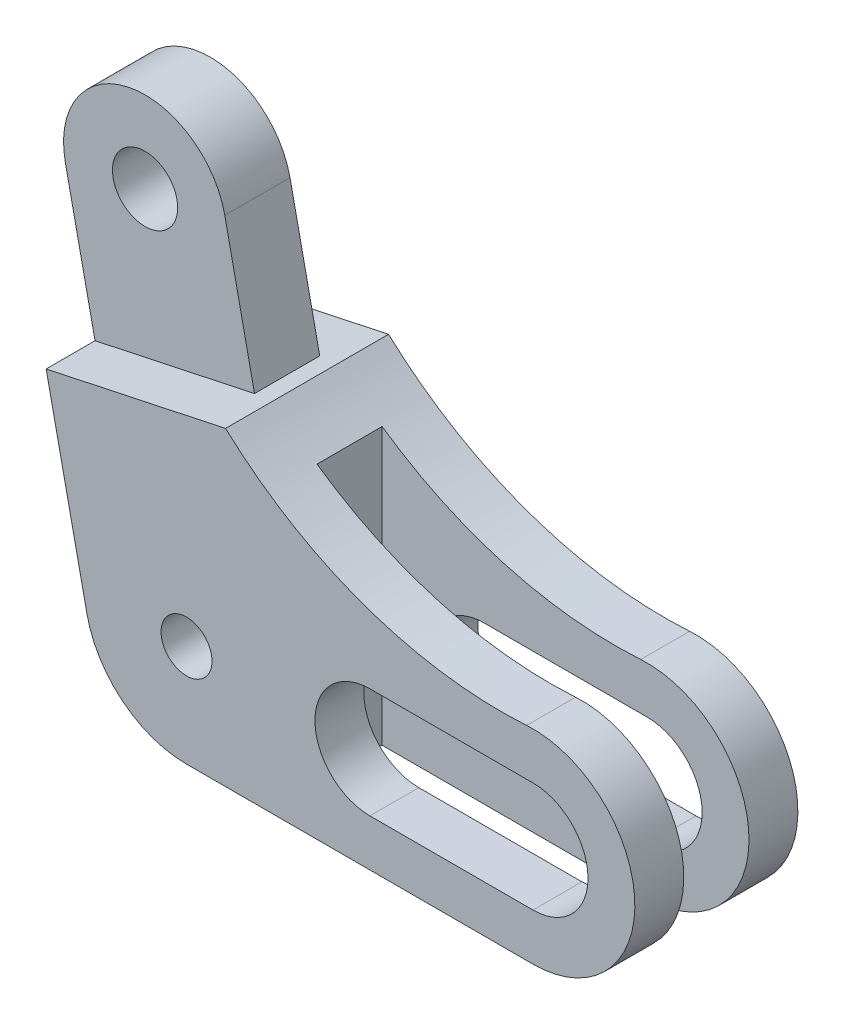
from build123d import *

# Parameters (mm, degrees)
SKETCH2_R               = 6.25
BOSS_EXTRUDE1_DEPTH     = 20
CUT_EXTRUDE1_DEPTH      = 123.932823709
CUT_EXTRUDE1_DEPTH_BACK = 123.932823709
SKETCH4_W               = 90
SKETCH4_H               = 16
SKETCH5_R               = 8
BOSS_EXTRUDE2_DEPTH     = 8


with BuildPart() as part:
    # Sketch2 → Boss-Extrude1 (new, symmetric)
    with BuildSketch(Plane.XY):
        with BuildLine():
            Line((0, -25), (85, -25))
            ThreePointArc((85, -25), (109.987866766, 0.7787904), (83.443175141, 24.951478841))
            ThreePointArc((83.443175141, 24.951478841), (43.835315137, 30.493200705), (9.566653282, 51.11241674))
            Line((9.566653282, 51.11241674), (-34.446959185, 41.742148997))
            Line((-34.446959185, 41.742148997), (-24.452006926, -5.205704301))
            ThreePointArc((-24.452006926, -5.205704301), (-15.729866377, -19.43119409), (0, -25))
        make_face()
        Circle(SKETCH2_R, mode=Mode.SUBTRACT)
        with BuildLine():
            Line((85, -13.5), (45, -13.5))
            ThreePointArc((45, -13.5), (31.5, 0), (45, 13.5))
            Line((45, 13.5), (85, 13.5))
            ThreePointArc((85, 13.5), (98.5, 0), (85, -13.5))
        make_face(mode=Mode.SUBTRACT)
    extrude(amount=BOSS_EXTRUDE1_DEPTH, both=True)

    # Sketch4 → Cut-Extrude1 (cut, two sides: drawn at the far end of the back side and taken through both)
    with BuildSketch(Plane(origin=(0, 0, 0), x_dir=(1, 0, 0), z_dir=(0, 1, 0)).offset(-CUT_EXTRUDE1_DEPTH_BACK)):
        with Locations((65, 0)):
            Rectangle(SKETCH4_W, SKETCH4_H)
    extrude(amount=CUT_EXTRUDE1_DEPTH + CUT_EXTRUDE1_DEPTH_BACK, mode=Mode.SUBTRACT)

    # Sketch5 → Boss-Extrude2 (add, symmetric)
    with BuildSketch(Plane.XY):
        with BuildLine():
            Line((-34.446959185, 41.742148997), (-41.734945207, 75.974958694))
            ThreePointArc((-41.734945207, 75.974958694), (-26.337903107, 99.701127676), (-2.611734125, 84.304085576))
            Line((-2.611734125, 84.304085576), (4.676251897, 50.071275879))
            Line((4.676251897, 50.071275879), (-34.446959185, 41.742148997))
        make_face()
        with Locations((-22.173339666, 80.139522135)):
            Circle(SKETCH5_R, mode=Mode.SUBTRACT)
    extrude(amount=BOSS_EXTRUDE2_DEPTH, both=True)


solid = part.part
